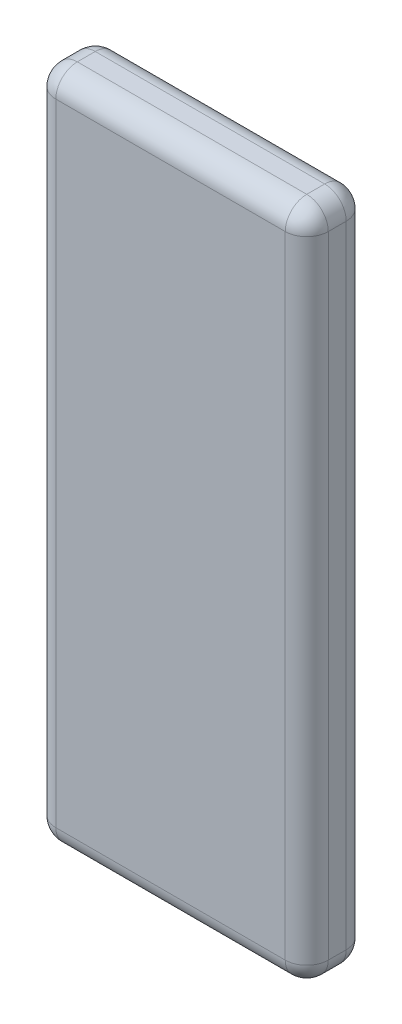
from build123d import *

# Parameters (mm, degrees)
BOSS_EXTRUDE1_DEPTH      = 940
BOSS_EXTRUDE1_DEPTH_BACK = 940
SKETCH1_W                = 760
SKETCH1_H                = 170
FILLET1_R                = 60


with BuildPart() as part:
    # Sketch1 → Boss-Extrude1 (new, two sides: drawn at the far end of the back side and taken through both)
    with BuildSketch(Plane(origin=(0, 0, 0), x_dir=(1, 0, 0), z_dir=(0, 1, 0)).offset(-BOSS_EXTRUDE1_DEPTH_BACK)):
        Rectangle(SKETCH1_W, SKETCH1_H)
    extrude(amount=BOSS_EXTRUDE1_DEPTH + BOSS_EXTRUDE1_DEPTH_BACK)

    # Fillet1
    fillet1_edges = [part.edges().sort_by_distance(p)[0] for p in [
        (380, 940, 0),
        (0, 940, 85),
        (-380, 940, 0),
        (0, 940, -85),
        (380, 0, -85),
        (380, 0, 85),
        (380, -940, 0),
        (0, -940, -85),
        (0, -940, 85),
        (-380, -940, 0),
        (-380, 0, 85),
        (-380, 0, -85),
    ]]
    fillet(fillet1_edges, radius=FILLET1_R)


solid = part.part
